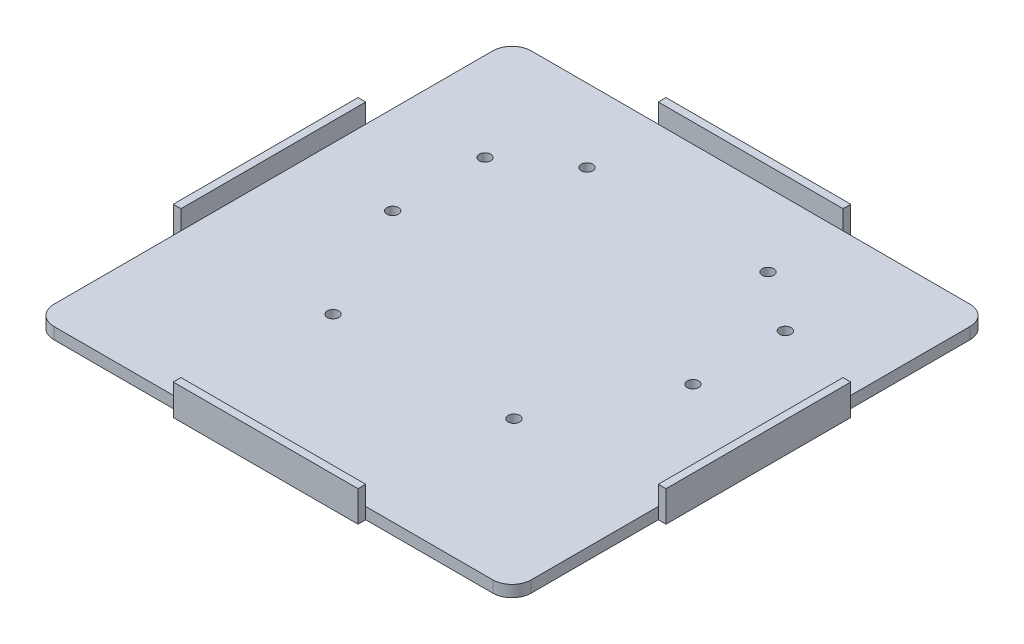
from build123d import *

# Parameters (mm, degrees)
SKETCH_1_W          = 128
SKETCH_1_H          = 128
EXTRUDE_1_DEPTH     = 8
CUT_EXTRUDE_1_DEPTH = 8
SKETCH_3_W          = 124
SKETCH_3_H          = 124
CUT_EXTRUDE_2_DEPTH = 5
FILLET_1_R          = 5
FILLET_2_R          = 5
FILLET_3_R          = 5
FILLET_4_R          = 5
SKETCH_4_R          = 1.5
CUT_EXTRUDE_3_DEPTH = 4


with BuildPart() as part:
    # 草图1 → 凸台-拉伸1 (new body)
    with BuildSketch(Plane(origin=(0, 0, 0), x_dir=(1, 0, 0), z_dir=(0, 1, 0))):
        Rectangle(SKETCH_1_W, SKETCH_1_H)
    extrude(amount=EXTRUDE_1_DEPTH)

    # 草图2 → 切除-拉伸1 (cut)
    with BuildSketch(Plane(origin=(0, 8, 0), x_dir=(1, 0, 0), z_dir=(0, 1, 0))):
        Polygon((-64, 64), (-64, 24), (-62, 24), (-62, 62), (-24, 62), (-24, 64), align=None)
        Polygon((-64, -24), (-62, -24), (-62, -62), (-24, -62), (-24, -64), (-64, -64), align=None)
        Polygon((24, -62), (24, -64), (64, -64), (64, -24), (62, -24), (62, -62), align=None)
        Polygon((64, 24), (62, 24), (62, 62), (24, 62), (24, 64), (64, 64), align=None)
    extrude(amount=-CUT_EXTRUDE_1_DEPTH, mode=Mode.SUBTRACT)

    # 草图3 → 切除-拉伸2 (cut)
    with BuildSketch(Plane(origin=(0, 8, 0), x_dir=(1, 0, 0), z_dir=(0, 1, 0))):
        Rectangle(SKETCH_3_W, SKETCH_3_H)
    extrude(amount=-CUT_EXTRUDE_2_DEPTH, mode=Mode.SUBTRACT)

    # 圆角1
    fillet_1_edges = [part.edges().sort_by_distance(p)[0] for p in [
        (-62, 1.5, 62),
    ]]
    fillet(fillet_1_edges, radius=FILLET_1_R)

    # 圆角2
    fillet_2_edges = [part.edges().sort_by_distance(p)[0] for p in [
        (62, 1.5, 62),
    ]]
    fillet(fillet_2_edges, radius=FILLET_2_R)

    # 圆角3
    fillet_3_edges = [part.edges().sort_by_distance(p)[0] for p in [
        (62, 1.5, -62),
    ]]
    fillet(fillet_3_edges, radius=FILLET_3_R)

    # 圆角4
    fillet_4_edges = [part.edges().sort_by_distance(p)[0] for p in [
        (-62, 1.5, -62),
    ]]
    fillet(fillet_4_edges, radius=FILLET_4_R)

    # 草图4 → 切除-拉伸3 (cut)
    with BuildSketch(Plane.XZ):
        with Locations(Location((-23.5, -43, 0), (0, 0, 270))):
            Circle(SKETCH_4_R)
        with Locations(Location((23.5, -43, 0), (0, 0, 270))):
            Circle(SKETCH_4_R)
        with Locations(Location((-23.5, 23, 0), (0, 0, 270))):
            Circle(SKETCH_4_R)
        with Locations(Location((23.5, 23, 0), (0, 0, 270))):
            Circle(SKETCH_4_R)
        with Locations(Location((-39, -32, 0), (0, 0, 270))):
            Circle(SKETCH_4_R)
        with Locations(Location((39, -32, 0), (0, 0, 270))):
            Circle(SKETCH_4_R)
        with Locations(Location((-39, -8, 0), (0, 0, 270))):
            Circle(SKETCH_4_R)
        with Locations(Location((39, -8, 0), (0, 0, 270))):
            Circle(SKETCH_4_R)
    extrude(amount=-CUT_EXTRUDE_3_DEPTH, mode=Mode.SUBTRACT)


solid = part.part
